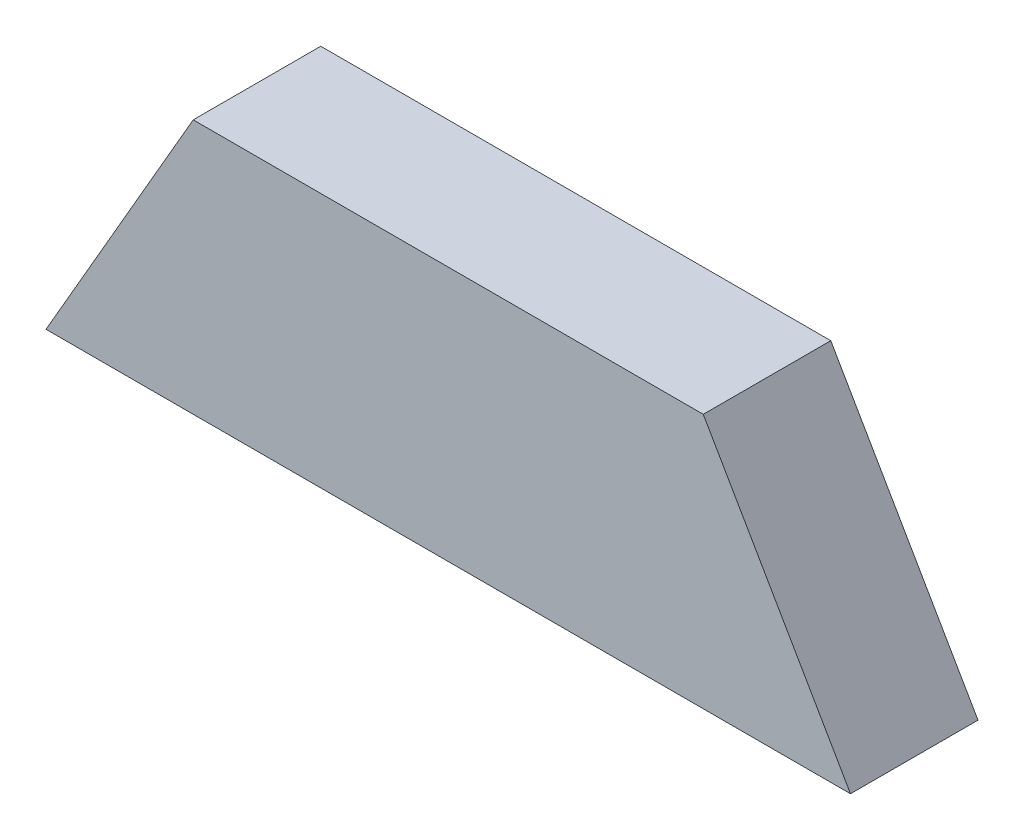
from build123d import *

# Parameters (mm, degrees)
BOSS_EXTRUDE1_DEPTH = 3.175


with BuildPart() as part:
    # Sketch1 → Boss-Extrude1 (new body)
    with BuildSketch(Plane.XY):
        Polygon((-6.35, 0), (6.35, 0), (10.016174209, -6.35), (-10.016174209, -6.35), align=None)
    extrude(amount=BOSS_EXTRUDE1_DEPTH)


solid = part.part
